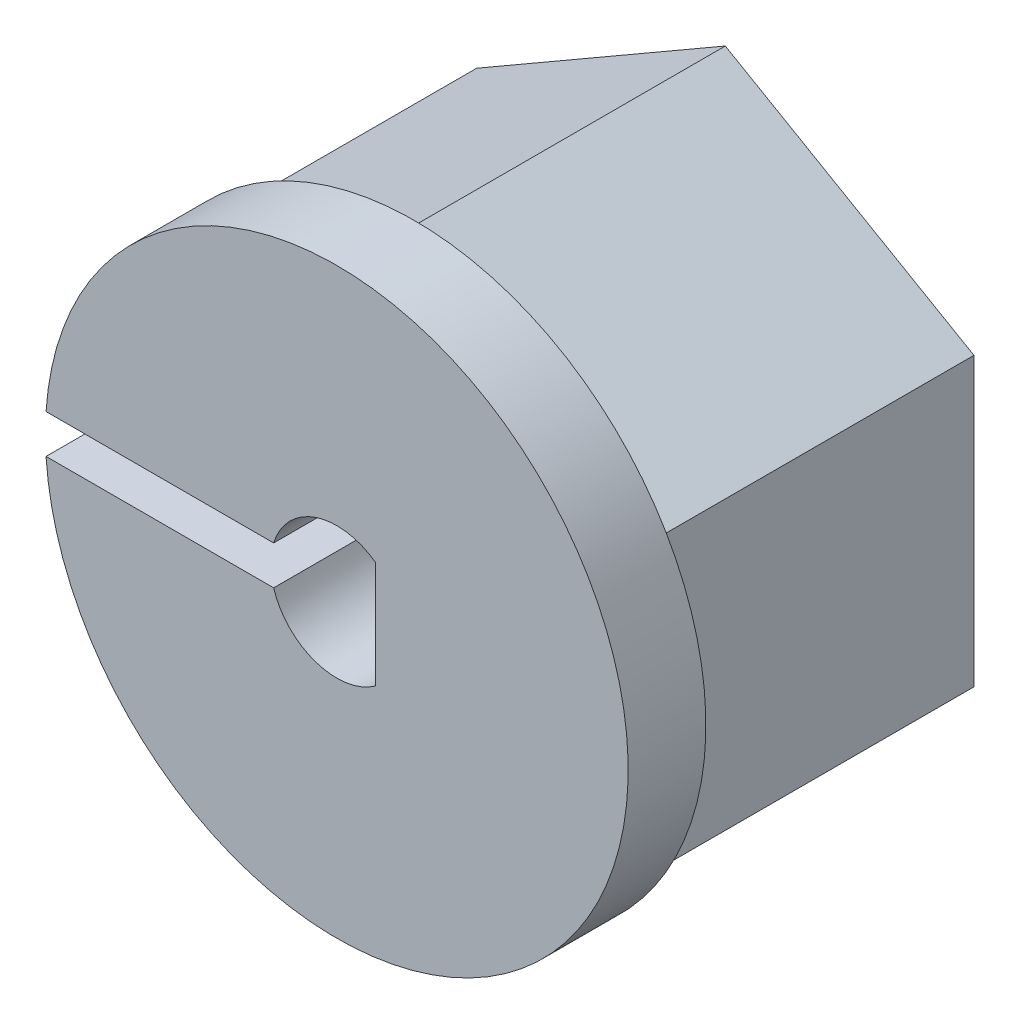
from build123d import *

# Parameters (mm, degrees)
BOSS_EXTRU_1_DEPTH      = 8
ESQUISSE2_R             = 7.5
BOSS_EXTRU_2_DEPTH      = 2
ENL_V_MAT_EXTRU_1_REACH = 16.577


with BuildPart() as part:
    # Esquisse1 → Boss.-Extru.1 (new body)
    with BuildSketch(Plane.XY):
        Polygon((0, 7.390083446), (-6.4, 3.695041723), (-6.4, -3.695041723), (0, -7.390083446), (6.4, -3.695041723), (6.4, 3.695041723), align=None)
    extrude(amount=BOSS_EXTRU_1_DEPTH)

    # Esquisse2 → Boss.-Extru.2 (add)
    with BuildSketch(Plane.XY.offset(8)):
        Circle(ESQUISSE2_R)
    extrude(amount=BOSS_EXTRU_2_DEPTH)

    # Esquisse3 → Enlèv. mat.-Extru.1 (cut, up to next)
    with BuildSketch(Plane(origin=(0, 0, 0), x_dir=(-1, 0, 0), z_dir=(0, 0, -1)), mode=Mode.PRIVATE) as enl_v_mat_extru_1_sk1:
        with BuildLine():
            Line((-1, 1.374772708), (-1, -1.374772708))
            ThreePointArc((-1, -1.374772708), (0.53749696, -1.612791684), (1.624807681, -0.5))
            Line((1.624807681, -0.5), (8.490964129, -0.5))
            Line((8.490964129, -0.5), (8.490964129, 0.5))
            Line((8.490964129, 0.5), (1.624807681, 0.5))
            ThreePointArc((1.624807681, 0.5), (0.53749696, 1.612791684), (-1, 1.374772708))
        make_face()
    enl_v_mat_extru_1_tool1 = extrude(enl_v_mat_extru_1_sk1.sketch, amount=-ENL_V_MAT_EXTRU_1_REACH, mode=Mode.PRIVATE) & part.part
    add(enl_v_mat_extru_1_tool1.solids().sort_by_distance((-2.500554, 0, 0))[0], mode=Mode.SUBTRACT)


solid = part.part
